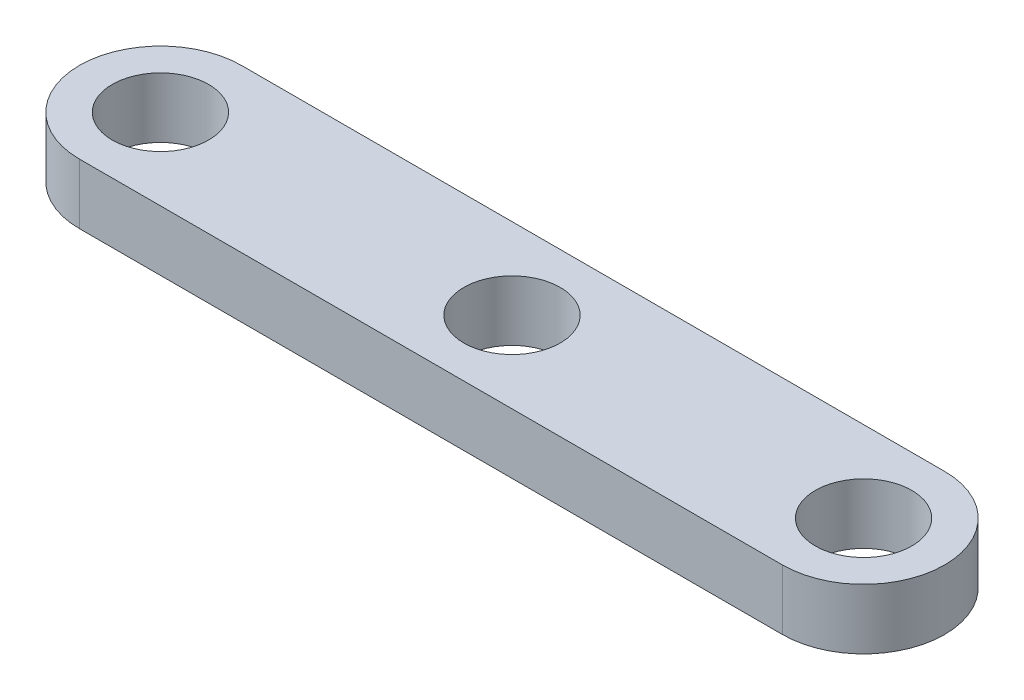
from build123d import *

# Parameters (mm, degrees)
SKETCH1_R           = 2.4
BOSS_EXTRUDE2_DEPTH = 3


with BuildPart() as part:
    # Sketch1 → Boss-Extrude2 (new body)
    with BuildSketch(Plane(origin=(0, 0, 0), x_dir=(1, 0, 0), z_dir=(0, 1, 0))):
        with BuildLine():
            Line((-17.5, 4.035), (17.5, 4.035))
            ThreePointArc((17.5, 4.035), (21.535, 0), (17.5, -4.035))
            Line((17.5, -4.035), (-17.5, -4.035))
            ThreePointArc((-17.5, -4.035), (-21.535, 0), (-17.5, 4.035))
        make_face()
        with Locations(Location((-17.5, 0, 0), (0, 0, 270))):
            Circle(SKETCH1_R, mode=Mode.SUBTRACT)
        with Locations(Location((17.5, 0, 0), (0, 0, 270))):
            Circle(SKETCH1_R, mode=Mode.SUBTRACT)
        with Locations(Location((0, 0, 0), (0, 0, 270))):
            Circle(SKETCH1_R, mode=Mode.SUBTRACT)
    extrude(amount=BOSS_EXTRUDE2_DEPTH)


solid = part.part
